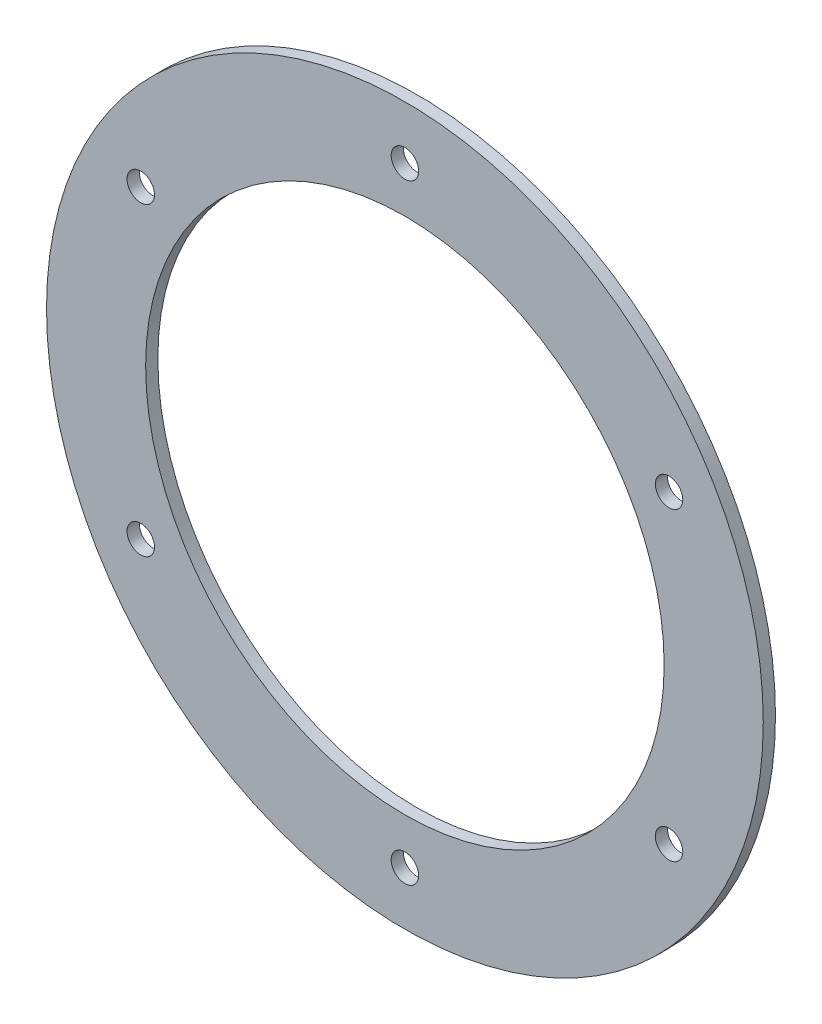
from build123d import *

# Parameters (mm, degrees)
SKETCH_1_R      = 117.5
SKETCH_1_R_2    = 85
SKETCH_1_R_3    = 4.5
EXTRUDE_1_DEPTH = 4
SCALE_1_SCALE   = 0.2


with BuildPart() as part:
    # 草图1 → 凸台-拉伸1 (new body)
    with BuildSketch(Plane.XY):
        Circle(SKETCH_1_R)
        Circle(SKETCH_1_R_2, mode=Mode.SUBTRACT)
        with Locations((0, 100)):
            Circle(SKETCH_1_R_3, mode=Mode.SUBTRACT)
        with Locations((86.602540378, 50)):
            Circle(SKETCH_1_R_3, mode=Mode.SUBTRACT)
        with Locations((86.602540378, -50)):
            Circle(SKETCH_1_R_3, mode=Mode.SUBTRACT)
        with Locations((0, -100)):
            Circle(SKETCH_1_R_3, mode=Mode.SUBTRACT)
        with Locations((-86.602540378, -50)):
            Circle(SKETCH_1_R_3, mode=Mode.SUBTRACT)
        with Locations((-86.602540378, 50)):
            Circle(SKETCH_1_R_3, mode=Mode.SUBTRACT)
    extrude(amount=EXTRUDE_1_DEPTH)


with BuildPart() as part_1:
    # 缩放比例1: scaled about (0, 0, 2)
    add(part.part.scale(SCALE_1_SCALE).moved(Location((0, 0, 1.6))))


solid = part_1.part
